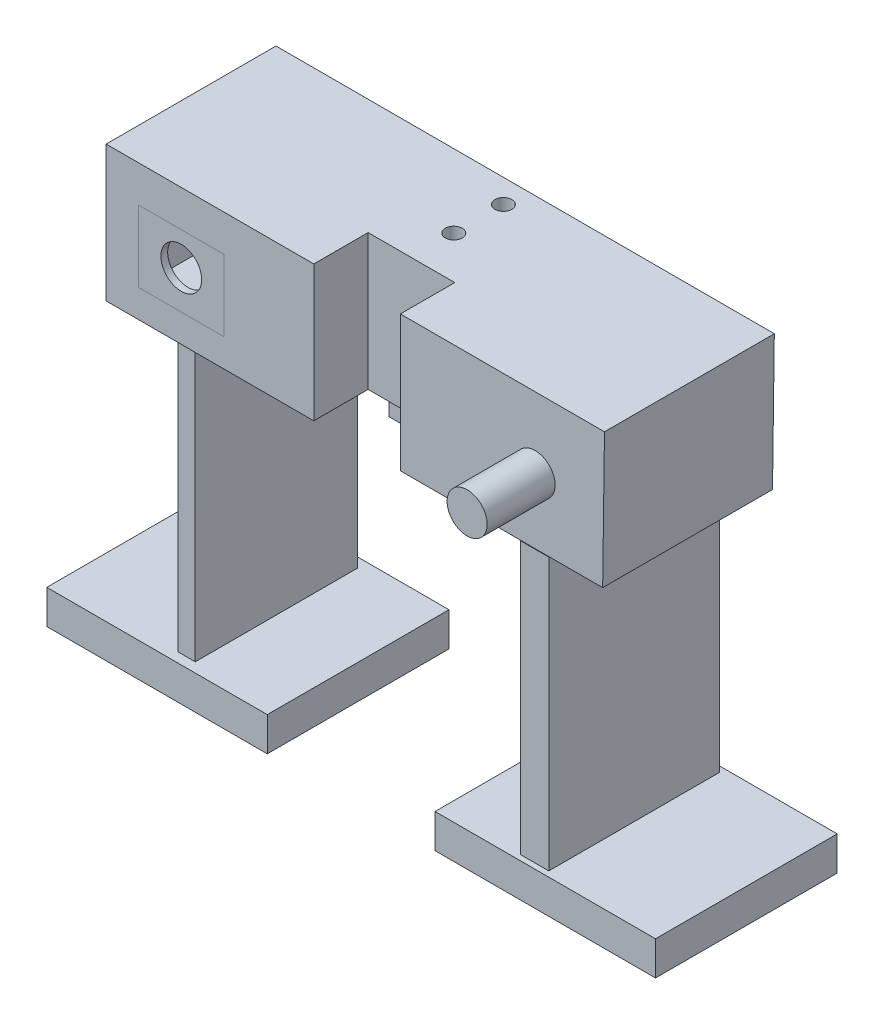
from build123d import *

# Parameters (mm, degrees)
SKETCH_1_W               = 88
SKETCH_1_H               = 25
EXTRUDE_2_DEPTH          = 20
SKETCH_4_W               = 2.551829688
SKETCH_4_H               = 23.885610852
EXTRUDE_5_DEPTH          = 40
SKETCH_5_W               = 4.19229163
SKETCH_5_H               = 25.15374978
EXTRUDE_6_DEPTH          = 40
SKETCH_6_W               = 89.600130436
SKETCH_6_H               = 26.746307592
EXTRUDE_7_DEPTH          = 5
SKETCH_7_W               = 12.6
SKETCH_7_H               = 10.5
CUT_EXTRUDE_1_DEPTH      = 69.567236571
SKETCH_8_W               = 12.6
SKETCH_8_H               = 10.5
EXTRUDE_8_DEPTH          = 1
SKETCH_10_R              = 2.95
EXTRUDE_9_DEPTH          = 10
SKETCH_2_W               = 12.749073286
SKETCH_2_H               = 25
EXTRUDE_10_DEPTH         = 5
SKETCH_14_W              = 24.692625752
SKETCH_14_H              = 26.746307592
CUT_EXTRUDE_3_DEPTH      = 10
SKETCH_15_W              = 12.749073286
SKETCH_15_H              = 11.05942892
CUT_EXTRUDE_4_DEPTH      = 5
SKETCH_16_R              = 3
CUT_EXTRUDE_5_DEPTH      = 5
SKETCH_29_W              = 7.06316408
SKETCH_29_H              = 20
CUT_EXTRUDE_6_DEPTH      = 69.567236571
CUT_EXTRUDE_7_DEPTH      = 69.567236571
CUT_EXTRUDE_8_DEPTH      = 69.567236571
CUT_EXTRUDE_8_DEPTH_BACK = 8
SKETCH_31_W              = 12.749073286
SKETCH_31_H              = 20


with BuildPart() as part:
    # 草圖1 → 填料-伸長2 (new body)
    with BuildSketch(Plane(origin=(0, 0, 0), x_dir=(1, 0, 0), z_dir=(0, 1, 0))):
        Rectangle(SKETCH_1_W, SKETCH_1_H)
    extrude(amount=EXTRUDE_2_DEPTH)

    # 草圖4 → 填料-伸長5 (add)
    with BuildSketch(Plane.XZ):
        with Locations((-25.655002041, 0)):
            Rectangle(SKETCH_4_W, SKETCH_4_H)
    extrude(amount=EXTRUDE_5_DEPTH)

    # 草圖5 → 填料-伸長6 (add)
    with BuildSketch(Plane.XZ):
        with Locations((26.201822688, 0)):
            Rectangle(SKETCH_5_W, SKETCH_5_H)
    extrude(amount=EXTRUDE_6_DEPTH)

    # 草圖6 → 填料-伸長7 (add)
    with BuildSketch(Plane.XZ.offset(40)):
        Rectangle(SKETCH_6_W, SKETCH_6_H)
    extrude(amount=EXTRUDE_7_DEPTH)

    # 草圖7 → 除料-伸長1 (cut, through all)
    with BuildSketch(Plane(origin=(0, 0, -12.5), x_dir=(-1, 0, 0), z_dir=(0, 0, -1))):
        with Locations((25.879907351, 9.361912681)):
            Rectangle(SKETCH_7_W, SKETCH_7_H)
    extrude(amount=-CUT_EXTRUDE_1_DEPTH, mode=Mode.SUBTRACT)

    # 草圖10 → 填料-伸長9 (add)
    with BuildSketch(Plane.XY.offset(12.5)):
        with Locations(Location((26.201822688, 9.558441428, 0), (0, 0, 180))):
            Circle(SKETCH_10_R)
    extrude(amount=EXTRUDE_9_DEPTH)

    # 草圖2 → 填料-伸長10 (add)
    with BuildSketch(Plane.XZ):
        Rectangle(SKETCH_2_W, SKETCH_2_H)
    extrude(amount=EXTRUDE_10_DEPTH)

    # 草圖14 → 除料-伸長3 (cut)
    with BuildSketch(Plane.XZ.offset(45)):
        Rectangle(SKETCH_14_W, SKETCH_14_H)
    extrude(amount=-CUT_EXTRUDE_3_DEPTH, mode=Mode.SUBTRACT)

    # 草圖15 → 除料-伸長4 (cut)
    with BuildSketch(Plane.XZ.offset(5)):
        with Locations((0, 6.97028554)):
            Rectangle(SKETCH_15_W, SKETCH_15_H)
    extrude(amount=-CUT_EXTRUDE_4_DEPTH, mode=Mode.SUBTRACT)

    # 草圖24 → M3 螺紋孔3 (revolve, cut)
    with BuildSketch(Plane(origin=(0, -5, -1.73731437), x_dir=(0, 0, -1), z_dir=(1, 0, 0))):
        Polygon((0, 0), (0, 25), (1.25, 25), (1.25, 0.230752399), (1.525, 0), align=None)
    revolve(axis=Axis((0, -11.35, -1.73731437), (0, 1, 0)), mode=Mode.SUBTRACT)

    # 草圖27 → M3 螺紋孔4 (revolve, cut)
    with BuildSketch(Plane(origin=(0, -5, -9.03731437), x_dir=(0, 0, -1), z_dir=(1, 0, 0))):
        Polygon((0, 0), (0, 25), (1.25, 25), (1.25, 0.230752399), (1.525, 0), align=None)
    revolve(axis=Axis((0, -11.35, -9.03731437), (0, 1, 0)), mode=Mode.SUBTRACT)

    # 草圖29 → 除料-伸長6 (cut, through all)
    with BuildSketch(Plane.XY.offset(12.5)):
        with Locations((-40.46841796, 10)):
            Rectangle(SKETCH_29_W, SKETCH_29_H)
    extrude(amount=-CUT_EXTRUDE_6_DEPTH, mode=Mode.SUBTRACT)

    # 草圖30 → 除料-伸長7 (cut, through all)
    with BuildSketch(Plane.XY.offset(12.5)):
        Polygon((36.414937256, 20), (36.148984252, 0), (44, 0), (44, 20), align=None)
    extrude(amount=-CUT_EXTRUDE_7_DEPTH, mode=Mode.SUBTRACT)

    # 草圖31 → 除料-伸長8 (cut, two sides: drawn at the far end of the back side and taken through both)
    with BuildSketch(Plane.XY.offset(12.5).offset(-CUT_EXTRUDE_8_DEPTH_BACK)):
        with Locations((0, 10)):
            Rectangle(SKETCH_31_W, SKETCH_31_H)
    extrude(amount=CUT_EXTRUDE_8_DEPTH + CUT_EXTRUDE_8_DEPTH_BACK, mode=Mode.SUBTRACT)


with BuildPart() as body_2:
    # 草圖8 → 填料-伸長8 (new body)
    with BuildSketch(Plane.XY.offset(12.5)):
        with Locations((-25.879907351, 9.361912681)):
            Rectangle(SKETCH_8_W, SKETCH_8_H)
    extrude(amount=-EXTRUDE_8_DEPTH)

    # 草圖16 → 除料-伸長5 (cut)
    with BuildSketch(Plane.XY.offset(12.5)):
        with Locations((-25.879907351, 9.751032881)):
            Circle(SKETCH_16_R)
    extrude(amount=-CUT_EXTRUDE_5_DEPTH, mode=Mode.SUBTRACT)


solid = Compound([part.part, body_2.part])
